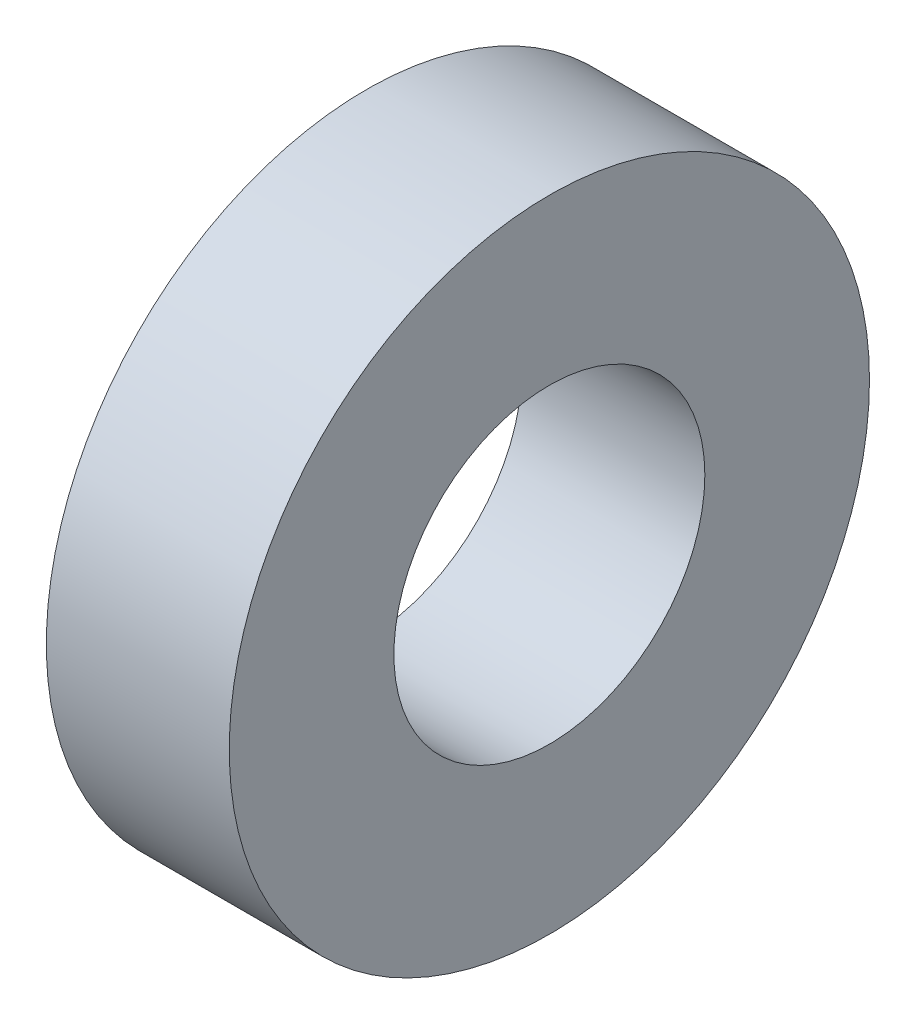
from build123d import *

# Parameters (mm, degrees)
SKETCH1_R           = 17.5
SKETCH1_R_2         = 8.5
BOSS_EXTRUDE1_DEPTH = 10


with BuildPart() as part:
    # Sketch1 → Boss-Extrude1 (new body)
    with BuildSketch(Plane(origin=(0, 0, 0), x_dir=(0, 0, -1), z_dir=(1, 0, 0))):
        Circle(SKETCH1_R)
        Circle(SKETCH1_R_2, mode=Mode.SUBTRACT)
    extrude(amount=BOSS_EXTRUDE1_DEPTH)


solid = part.part
